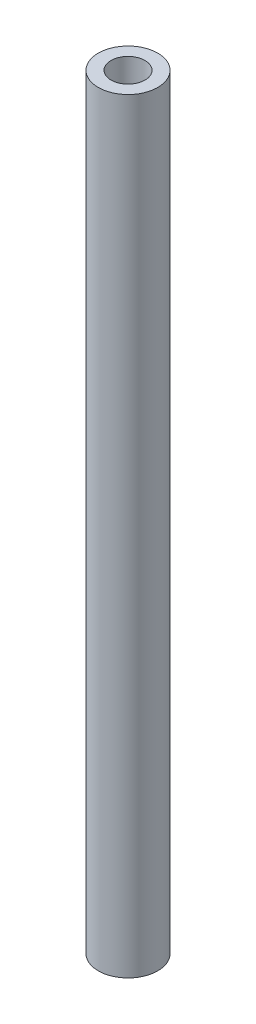
from build123d import *

# Parameters (mm, degrees)
SKETCH_1_R      = 1.75
SKETCH_1_R_2    = 1
EXTRUDE_1_DEPTH = 45


with BuildPart() as part:
    # 草图1 → 凸台-拉伸1 (new body)
    with BuildSketch(Plane(origin=(0, 0, 0), x_dir=(1, 0, 0), z_dir=(0, 1, 0))):
        with Locations(Location((0, 0, 0), (0, 0, 90))):
            Circle(SKETCH_1_R)
        with Locations(Location((0, 0, 0), (0, 0, 90))):
            Circle(SKETCH_1_R_2, mode=Mode.SUBTRACT)
    extrude(amount=EXTRUDE_1_DEPTH)


solid = part.part
